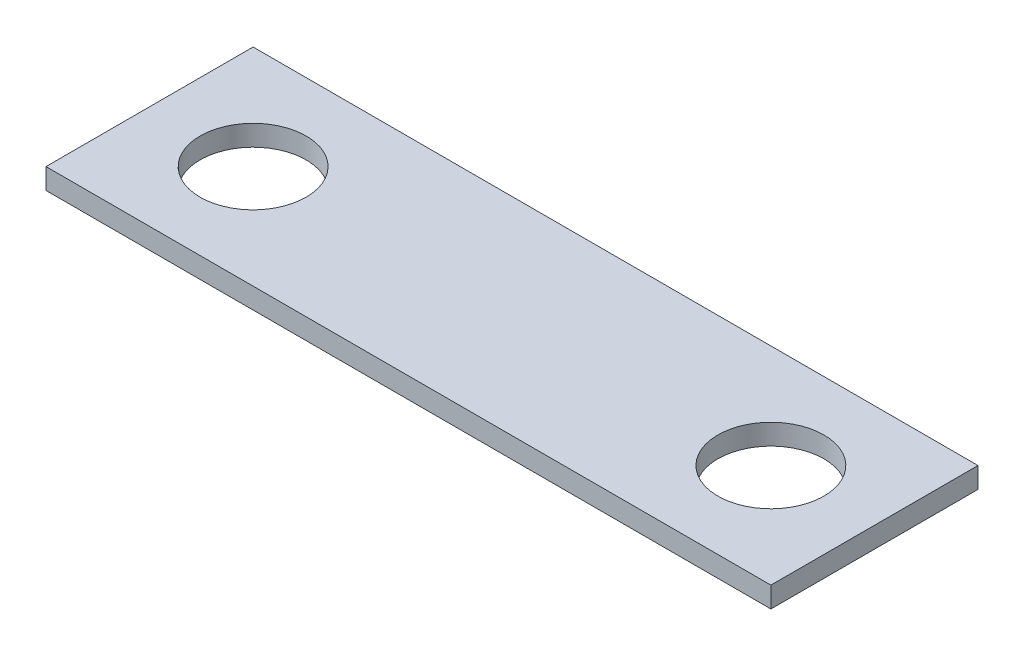
from build123d import *

# Parameters (mm, degrees)
SKETCH1_W           = 44.45
SKETCH1_H           = 12.7
SKETCH1_R           = 3.2512
BOSS_EXTRUDE1_DEPTH = 1.27


with BuildPart() as part:
    # Sketch1 → Boss-Extrude1 (new body)
    with BuildSketch(Plane(origin=(0, 0, 0), x_dir=(1, 0, 0), z_dir=(0, 1, 0))):
        with Locations((22.225, 6.35)):
            Rectangle(SKETCH1_W, SKETCH1_H)
        with Locations(Location((6.35, 6.35, 0), (0, 0, 270))):
            Circle(SKETCH1_R, mode=Mode.SUBTRACT)
        with Locations(Location((38.1, 6.35, 0), (0, 0, 90))):
            Circle(SKETCH1_R, mode=Mode.SUBTRACT)
    extrude(amount=BOSS_EXTRUDE1_DEPTH)


solid = part.part
